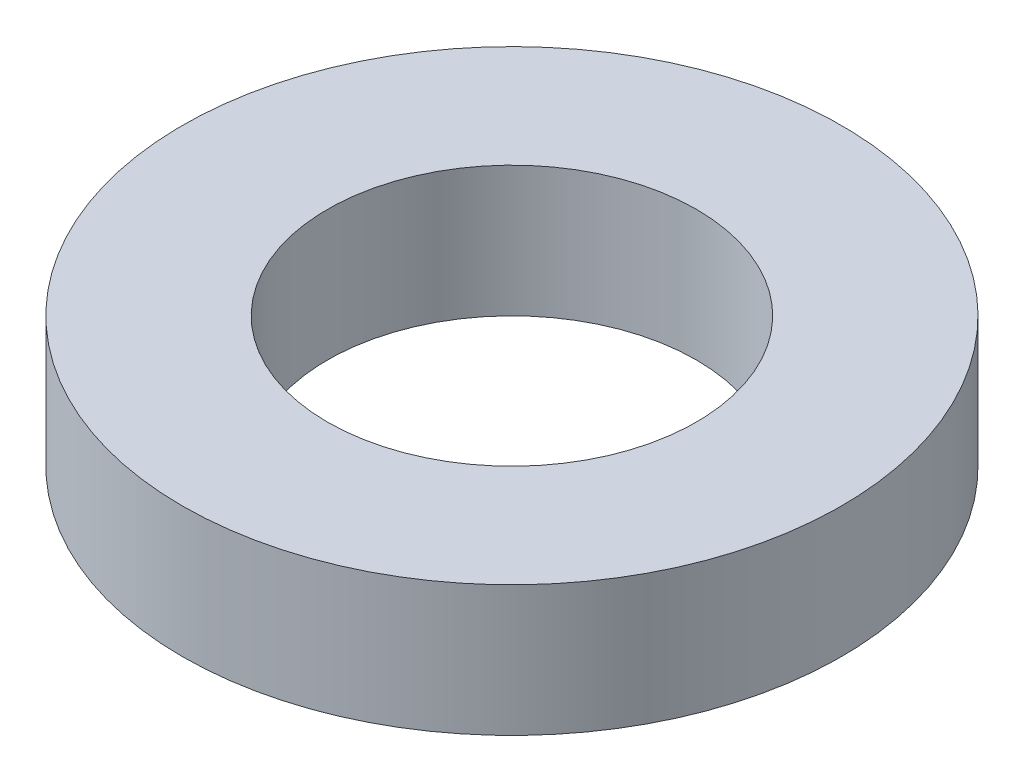
from build123d import *

# Parameters (mm, degrees)
SKETCH1_R           = 126.270000063
BOSS_EXTRUDE1_DEPTH = 50
SKETCH3_R           = 70.645843196
CUT_EXTRUDE1_DEPTH  = 186.440626163


with BuildPart() as part:
    # Sketch1 → Boss-Extrude1 (new body)
    with BuildSketch(Plane(origin=(0, 0, 0), x_dir=(1, 0, 0), z_dir=(0, 1, 0))):
        with Locations(Location((0, 0, 0), (0, 0, 270))):
            Circle(SKETCH1_R)
    extrude(amount=BOSS_EXTRUDE1_DEPTH)

    # Sketch3 → Cut-Extrude1 (cut, through all)
    with BuildSketch(Plane(origin=(0, 50, 0), x_dir=(1, 0, 0), z_dir=(0, 1, 0))):
        with Locations(Location((0, 0, 0), (0, 0, 270))):
            Circle(SKETCH3_R)
    extrude(amount=-CUT_EXTRUDE1_DEPTH, mode=Mode.SUBTRACT)


solid = part.part
